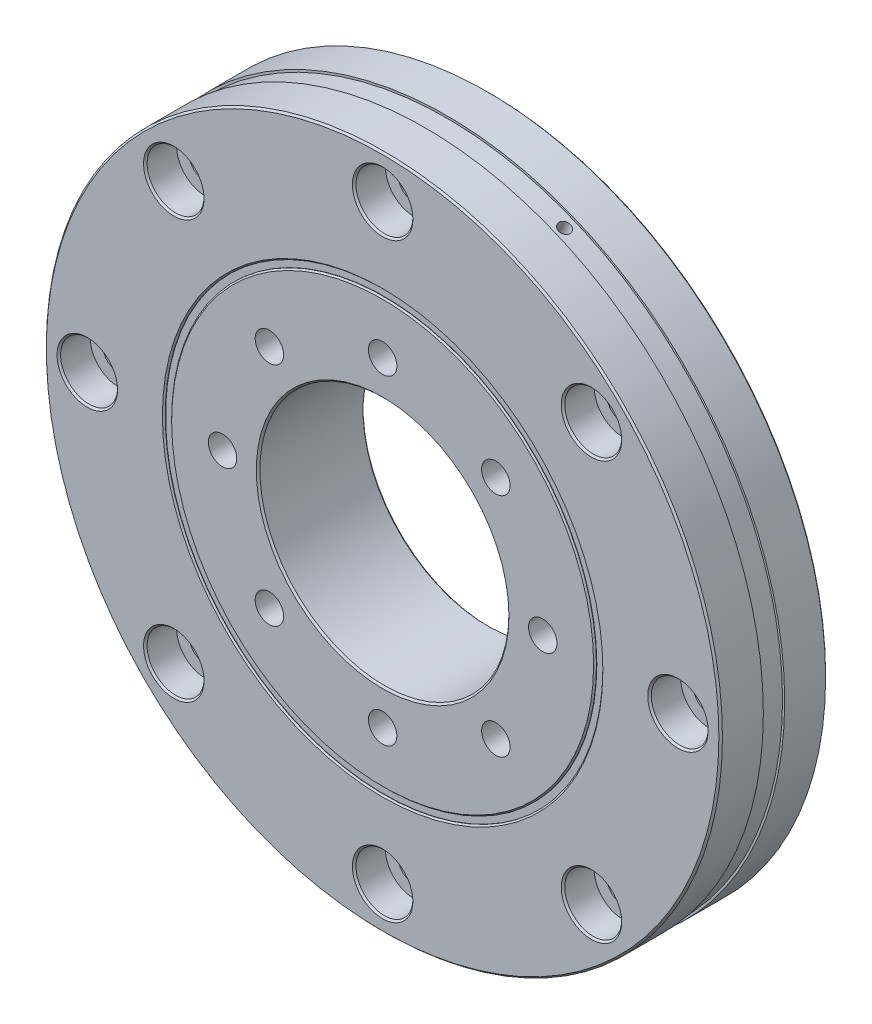
from build123d import *

# Parameters (mm, degrees)
BOSS_EXTRUDE1_DEPTH          = 7.5
BOSS_EXTRUDE1_DEPTH_BACK     = 7.5
SKETCH4_R                    = 2
CIRPATTERN1_COUNT            = 8
BOSS_EXTRUDE4_DEPTH          = 7.5
BOSS_EXTRUDE4_DEPTH_BACK     = 7.5
SKETCH9_R                    = 47.5
SKETCH9_R_2                  = 17.5
SKETCH10_R                   = 4
CUT_EXTRUDE1_DEPTH           = 4.4
SKETCH11_R                   = 2.25
CUT_EXTRUDE2_DEPTH           = 69.82949949
CHAMFER2_SIZE                = 0.25
CHAMFER1_SIZE                = 0.25
CIRPATTERN2_COUNT            = 8
CHAMFER2_OF_CIRPATTERN2_SIZE = 0.25
SKETCH12_W                   = 0.25
SKETCH12_H                   = 0.9
SKETCH12_W_2                 = 3
SKETCH12_H_2                 = 0.3
SKETCH13_W                   = 0.825
SKETCH13_H                   = 17.2
CIRPATTERN3_COUNT            = 2
CHAMFER3_SIZE                = 0.2


with BuildPart() as part:
    # Sketch4 → Boss-Extrude1 (new, two sides: drawn at the far end of the back side and taken through both)
    with BuildSketch(Plane.XY.offset(-BOSS_EXTRUDE1_DEPTH_BACK)):
        with Locations((0, 22.5)):
            Circle(SKETCH4_R)
    extrude(amount=BOSS_EXTRUDE1_DEPTH + BOSS_EXTRUDE1_DEPTH_BACK)

    # Boss-Extrude2 cone 1 section (through the dimple's axis) → Boss-Extrude2 (revolve)
    with BuildSketch(Plane(origin=(0, 22.5, 7.5), x_dir=(0, -1, 0), z_dir=(1, 0, 0))):
        Polygon((0, 0), (2, 0), (0, 2), align=None)
    revolve(axis=Axis((0, 22.5, 7.5), (0, 0, -1)))

    # Boss-Extrude3 cone 1 section (through the dimple's axis) → Boss-Extrude3 (revolve)
    with BuildSketch(Plane(origin=(0, 22.5, -7.5), x_dir=(0, 1, 0), z_dir=(1, 0, 0))):
        Polygon((0, 0), (2, 0), (0, 2), align=None)
    revolve(axis=Axis((0, 22.5, -7.5), (0, 0, 1)))


with BuildPart() as cirpattern1_1:
    # CirPattern1: pattern copy
    add(part.part.rotate(Axis((0, 0, 0), (0, 0, 1)), 1 * 360 / CIRPATTERN1_COUNT))


with BuildPart() as cirpattern1_2:
    # CirPattern1: pattern copy
    add(part.part.rotate(Axis((0, 0, 0), (0, 0, 1)), 2 * 360 / CIRPATTERN1_COUNT))


with BuildPart() as cirpattern1_3:
    # CirPattern1: pattern copy
    add(part.part.rotate(Axis((0, 0, 0), (0, 0, 1)), 3 * 360 / CIRPATTERN1_COUNT))


with BuildPart() as cirpattern1_4:
    # CirPattern1: pattern copy
    add(part.part.rotate(Axis((0, 0, 0), (0, 0, 1)), 4 * 360 / CIRPATTERN1_COUNT))


with BuildPart() as cirpattern1_5:
    # CirPattern1: pattern copy
    add(part.part.rotate(Axis((0, 0, 0), (0, 0, 1)), 5 * 360 / CIRPATTERN1_COUNT))


with BuildPart() as cirpattern1_6:
    # CirPattern1: pattern copy
    add(part.part.rotate(Axis((0, 0, 0), (0, 0, 1)), 6 * 360 / CIRPATTERN1_COUNT))


with BuildPart() as cirpattern1_7:
    # CirPattern1: pattern copy
    add(part.part.rotate(Axis((0, 0, 0), (0, 0, 1)), 7 * 360 / CIRPATTERN1_COUNT))


with BuildPart() as body_9:
    # Sketch9 → Boss-Extrude4 (new, two sides: drawn at the far end of the back side and taken through both)
    with BuildSketch(Plane.XY.offset(-BOSS_EXTRUDE4_DEPTH_BACK)):
        Circle(SKETCH9_R)
        Circle(SKETCH9_R_2, mode=Mode.SUBTRACT)
    extrude(amount=BOSS_EXTRUDE4_DEPTH + BOSS_EXTRUDE4_DEPTH_BACK)

    # Combine1: cut CirPattern1_3, CirPattern1_1, CirPattern1_2, part, CirPattern1_6, CirPattern1_5, CirPattern1_4, CirPattern1_7
    add(cirpattern1_3.part, mode=Mode.SUBTRACT)
    add(cirpattern1_1.part, mode=Mode.SUBTRACT)
    add(cirpattern1_2.part, mode=Mode.SUBTRACT)
    add(part.part, mode=Mode.SUBTRACT)
    add(cirpattern1_6.part, mode=Mode.SUBTRACT)
    add(cirpattern1_5.part, mode=Mode.SUBTRACT)
    add(cirpattern1_4.part, mode=Mode.SUBTRACT)
    add(cirpattern1_7.part, mode=Mode.SUBTRACT)

    # Sketch10 → Cut-Extrude1 (cut)
    with BuildSketch(Plane.XY.offset(7.5)):
        with Locations((0, 41.5)):
            Circle(SKETCH10_R)
    cut_extrude1 = extrude(amount=-CUT_EXTRUDE1_DEPTH, mode=Mode.SUBTRACT)

    # Sketch11 → Cut-Extrude2 (cut, through all)
    with BuildSketch(Plane.XY.offset(7.5)):
        with Locations((0, 41.5)):
            Circle(SKETCH11_R)
    cut_extrude2 = extrude(amount=-CUT_EXTRUDE2_DEPTH, mode=Mode.SUBTRACT)

    # Chamfer2
    chamfer2_edges = [body_9.edges().sort_by_distance(p)[0] for p in [
        (-4, 41.5, 7.5),
    ]]
    chamfer(chamfer2_edges, length=CHAMFER2_SIZE)

    # Chamfer1
    chamfer1_edges = [body_9.edges().sort_by_distance(p)[0] for p in [
        (-47.5, 0, -7.5),
        (-17.5, 0, -7.5),
        (-47.5, 0, 7.5),
        (-17.5, 0, 7.5),
    ]]
    chamfer(chamfer1_edges, length=CHAMFER1_SIZE)

    # CirPattern2: Cut-Extrude1, Cut-Extrude2 ×8 about axis
    cirpattern2_axis = Axis((0, 0, 0), (0, 0, 1))
    add([cut_extrude1.rotate(cirpattern2_axis, i * 360 / CIRPATTERN2_COUNT) for i in range(1, CIRPATTERN2_COUNT)], mode=Mode.SUBTRACT)
    add([cut_extrude2.rotate(cirpattern2_axis, i * 360 / CIRPATTERN2_COUNT) for i in range(1, CIRPATTERN2_COUNT)], mode=Mode.SUBTRACT)

    # Chamfer2 of CirPattern2
    chamfer2_of_cirpattern2_edges = [body_9.edges().sort_by_distance(p)[0] for p in [
        (-32.173358544, 26.516504294, 7.5),
        (-41.5, -4, 7.5),
        (-26.516504294, -32.173358544, 7.5),
        (4, -41.5, 7.5),
        (32.173358544, -26.516504294, 7.5),
        (41.5, 4, 7.5),
        (26.516504294, 32.173358544, 7.5),
    ]]
    chamfer(chamfer2_of_cirpattern2_edges, length=CHAMFER2_OF_CIRPATTERN2_SIZE)

    # Sketch12 → Cut-Revolve1 (revolve, cut)
    with BuildSketch(Plane(origin=(0, 0, 0), x_dir=(0, 0, -1), z_dir=(1, 0, 0)), mode=Mode.PRIVATE) as cut_revolve1_sk:
        with Locations((-7.375, 30.3)):
            Rectangle(SKETCH12_W, SKETCH12_H)
        with Locations((7.375, 30.3)):
            Rectangle(SKETCH12_W, SKETCH12_H)
        with Locations((0, 47.35)):
            Rectangle(SKETCH12_W_2, SKETCH12_H_2)
    revolve(cut_revolve1_sk.sketch.rotate(Axis((0, 0, 7.5), (0, 0, -1)), 90), axis=Axis((0, 0, 7.5), (0, 0, -1)), mode=Mode.SUBTRACT)

    # Sketch13 → Cut-Revolve2 (revolve, cut)
    with BuildSketch(Plane(origin=(0, 0, 0), x_dir=(0, 0, -1), z_dir=(0.9238795325112865, -0.3826834323650906, 0)), mode=Mode.PRIVATE) as cut_revolve2_sk:
        with Locations((-0.4125, 38.9)):
            Rectangle(SKETCH13_W, SKETCH13_H)
    cut_revolve2 = revolve(cut_revolve2_sk.sketch.rotate(Axis((11.854473416, 28.619230496, 0), (-0.3826834323650891, -0.9238795325112871, 0)), 90), axis=Axis((11.854473416, 28.619230496, 0), (-0.3826834323650891, -0.9238795325112871, 0)), mode=Mode.SUBTRACT)

    # CirPattern3: Cut-Revolve2 ×2 about axis
    cirpattern3_axis = Axis((0, 0, 7.5), (0, 0, -1))
    for i in range(1, CIRPATTERN3_COUNT):
        add(cut_revolve2.rotate(cirpattern3_axis, i * 360 / CIRPATTERN3_COUNT), mode=Mode.SUBTRACT)

    # Chamfer3
    chamfer3_edges = [body_9.edges().sort_by_distance(p)[0] for p in [
        (-30.75, 0, 7.5),
        (-29.85, 0, 7.5),
    ]]
    chamfer(chamfer3_edges, length=CHAMFER3_SIZE)


solid = body_9.part
